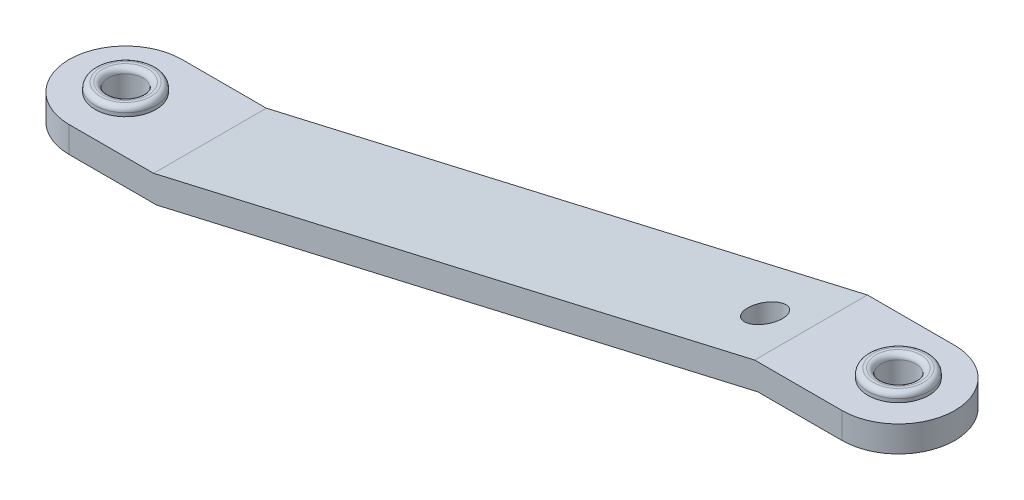
from build123d import *

# Parameters (mm, degrees)
EXTRUDE_THIN1_DEPTH      = 32.5
FILLET1_RADIUS           = 32.5
FILLET1_LENGTH           = 15
FILLET2_RADIUS           = 32.5
FILLET2_LENGTH           = 15
SKETCH2_R                = 10
CUT_EXTRUDE1_DEPTH       = 441.123830606
BOSS_EXTRUDE1_DEPTH      = 5
BOSS_EXTRUDE1_DEPTH_BACK = 20
SKETCH3_R                = 17.5
SKETCH3_R_2              = 10
BOSS_EXTRUDE2_DEPTH      = 5
BOSS_EXTRUDE2_DEPTH_BACK = 20
SKETCH4_R                = 17.5
SKETCH4_R_2              = 10
FILLET3_R                = 3


with BuildPart() as part:
    # Sketch1 → Extrude-Thin1 (new, symmetric)
    with BuildSketch(Plane.XY):
        Polygon((-82, -7.5), (0.854517062, -7.5), (347.372587005, 72.5), (428.518069943, 72.5), (428.518069943, 87.5), (345.66355288, 87.5), (-0.854517062, 7.5), (-82, 7.5), align=None)
    extrude(amount=EXTRUDE_THIN1_DEPTH, both=True)

    # Fillet1: full round fillet: the end face becomes a half cylinder, R = half its width
    fillet1_face = Plane((-82, 0, 0), x_dir=(0, 1, 0), z_dir=(-1, 0, 0))  # on the end face: x along it, z out of the body
    fillet1_slab = fillet1_face.offset(-FILLET1_RADIUS / 2) * Box(FILLET1_LENGTH, 2 * FILLET1_RADIUS, FILLET1_RADIUS, mode=Mode.PRIVATE)  # the body's end, R deep
    fillet1_round = Plane((-49.5, 0, 0), x_dir=(-1, 0, 0), z_dir=(0, 1, 0)) * Cylinder(FILLET1_RADIUS, FILLET1_LENGTH, mode=Mode.PRIVATE)  # its axis R under the face
    add(fillet1_slab - fillet1_round, mode=Mode.SUBTRACT)

    # Fillet2: full round fillet: the end face becomes a half cylinder, R = half its width
    fillet2_face = Plane((428.518069943, 80, 0), x_dir=(0, -1, 0), z_dir=(1, 0, 0))  # on the end face: x along it, z out of the body
    fillet2_slab = fillet2_face.offset(-FILLET2_RADIUS / 2) * Box(FILLET2_LENGTH, 2 * FILLET2_RADIUS, FILLET2_RADIUS, mode=Mode.PRIVATE)  # the body's end, R deep
    fillet2_round = Plane((396.018069943, 80, 0), x_dir=(1, 0, 0), z_dir=(0, -1, 0)) * Cylinder(FILLET2_RADIUS, FILLET2_LENGTH, mode=Mode.PRIVATE)  # its axis R under the face
    add(fillet2_slab - fillet2_round, mode=Mode.SUBTRACT)

    # Sketch2 → Cut-Extrude1 (cut, through all)
    with BuildSketch(Plane(origin=(0, 87.5, 0), x_dir=(1, 0, 0), z_dir=(0, 1, 0))):
        with Locations(Location((396.018069943, 0, 0), (0, 0, 270))):
            Circle(SKETCH2_R)
        with Locations(Location((-49.5, 0, 0), (0, 0, 270))):
            Circle(SKETCH2_R)
        with Locations((319.145482938, 0)):
            Circle(SKETCH2_R)
    extrude(amount=-CUT_EXTRUDE1_DEPTH, mode=Mode.SUBTRACT)

    # Sketch3 → Boss-Extrude1 (add, two sides: drawn at the far end of the back side and taken through both)
    with BuildSketch(Plane(origin=(0, 7.5, 0), x_dir=(1, 0, 0), z_dir=(0, 1, 0)).offset(-BOSS_EXTRUDE1_DEPTH_BACK)):
        with Locations(Location((-49.5, 0, 0), (0, 0, 270))):
            Circle(SKETCH3_R)
        with Locations(Location((-49.5, 0, 0), (0, 0, 270))):
            Circle(SKETCH3_R_2, mode=Mode.SUBTRACT)
    extrude(amount=BOSS_EXTRUDE1_DEPTH + BOSS_EXTRUDE1_DEPTH_BACK)

    # Sketch4 → Boss-Extrude2 (add, two sides: drawn at the far end of the back side and taken through both)
    with BuildSketch(Plane(origin=(0, 87.5, 0), x_dir=(1, 0, 0), z_dir=(0, 1, 0)).offset(-BOSS_EXTRUDE2_DEPTH_BACK)):
        with Locations(Location((396.018069943, 0, 0), (0, 0, 270))):
            Circle(SKETCH4_R)
        with Locations(Location((396.018069943, 0, 0), (0, 0, 270))):
            Circle(SKETCH4_R_2, mode=Mode.SUBTRACT)
    extrude(amount=BOSS_EXTRUDE2_DEPTH + BOSS_EXTRUDE2_DEPTH_BACK)

    # Fillet3
    fillet3_edges = [part.edges().sort_by_distance(p)[0] for p in [
        (-49.5, -12.5, -10),
        (-49.5, -12.5, -17.5),
        (-49.5, 12.5, -10),
        (-49.5, 12.5, -17.5),
        (396.018069943, 67.5, -17.5),
        (396.018069943, 92.5, -10),
        (396.018069943, 92.5, -17.5),
    ]]
    fillet(fillet3_edges, radius=FILLET3_R)


solid = part.part
